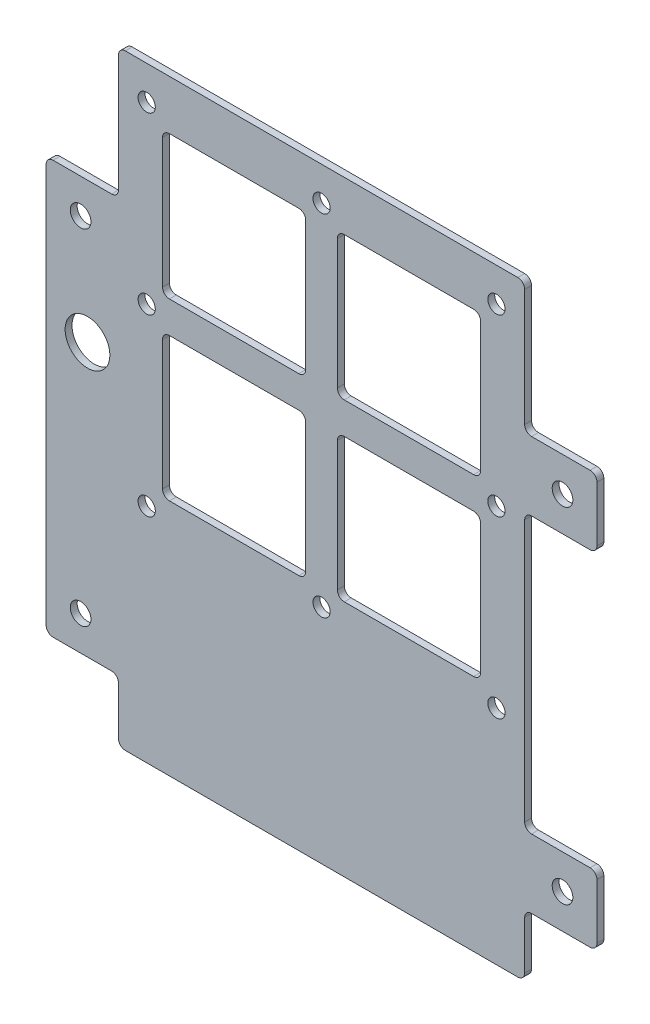
from build123d import *

# Parameters (mm, degrees)
MODEL_R         = 1.5
MODEL_R_2       = 3.25
MODEL_R_3       = 1.25
EXTRUDE_1_DEPTH = 1


with BuildPart() as part:
    # Model → Бобышка-Вытянуть1 (new body)
    with BuildSketch(Plane.XY):
        with BuildLine():
            Line((-28.5, -69), (28.5, -69))
            ThreePointArc((28.5, -69), (29.207106781, -68.707106781), (29.5, -68))
            Line((29.5, -68), (29.5, -61))
            ThreePointArc((29.5, -61), (29.792893219, -60.292893219), (30.5, -60))
            Line((30.5, -60), (39, -60))
            ThreePointArc((39, -60), (39.707106781, -59.707106781), (40, -59))
            Line((40, -59), (40, -55))
            Line((40, -55), (40, -51))
            ThreePointArc((40, -51), (39.707106781, -50.292893219), (39, -50))
            Line((39, -50), (30.5, -50))
            ThreePointArc((30.5, -50), (29.792893219, -49.707106781), (29.5, -49))
            Line((29.5, -49), (29.5, -11))
            ThreePointArc((29.5, -11), (29.792893219, -10.292893219), (30.5, -10))
            Line((30.5, -10), (39, -10))
            ThreePointArc((39, -10), (39.707106781, -9.707106781), (40, -9))
            Line((40, -9), (40, -5))
            Line((40, -5), (40, -1))
            ThreePointArc((40, -1), (39.707106781, -0.292893219), (39, 0))
            Line((39, 0), (30.5, 0))
            ThreePointArc((30.5, 0), (29.792893219, 0.292893219), (29.5, 1))
            Line((29.5, 1), (29.5, 18))
            ThreePointArc((29.5, 18), (29.207106781, 18.707106781), (28.5, 19))
            Line((28.5, 19), (-28.5, 19))
            ThreePointArc((-28.5, 19), (-29.207106781, 18.707106781), (-29.5, 18))
            Line((-29.5, 18), (-29.5, 1))
            ThreePointArc((-29.5, 1), (-29.792893219, 0.292893219), (-30.5, 0))
            Line((-30.5, 0), (-39, 0))
            ThreePointArc((-39, 0), (-39.707106781, -0.292893219), (-40, -1))
            Line((-40, -1), (-40, -5))
            Line((-40, -5), (-40, -9))
            Line((-40, -9), (-40, -52))
            Line((-40, -52), (-40, -55))
            Line((-40, -55), (-40, -59))
            ThreePointArc((-40, -59), (-39.707106781, -59.707106781), (-39, -60))
            Line((-39, -60), (-30.5, -60))
            ThreePointArc((-30.5, -60), (-29.792893219, -60.292893219), (-29.5, -61))
            Line((-29.5, -61), (-29.5, -68))
            ThreePointArc((-29.5, -68), (-29.207106781, -68.707106781), (-28.5, -69))
        make_face()
        with Locations((-35, -5)):
            Circle(MODEL_R, mode=Mode.SUBTRACT)
        with Locations((-35, -55)):
            Circle(MODEL_R, mode=Mode.SUBTRACT)
        with Locations((35, -5)):
            Circle(MODEL_R, mode=Mode.SUBTRACT)
        with Locations((35, -55)):
            Circle(MODEL_R, mode=Mode.SUBTRACT)
        with Locations((-34, -20.4)):
            Circle(MODEL_R_2, mode=Mode.SUBTRACT)
        with Locations((25.4, -36.7)):
            Circle(MODEL_R_3, mode=Mode.SUBTRACT)
        with Locations((0, -36.7)):
            Circle(MODEL_R_3, mode=Mode.SUBTRACT)
        with Locations((25.4, 14.1)):
            Circle(MODEL_R_3, mode=Mode.SUBTRACT)
        with Locations((0, 14.1)):
            Circle(MODEL_R_3, mode=Mode.SUBTRACT)
        with Locations((-25.4, -11.3)):
            Circle(MODEL_R_3, mode=Mode.SUBTRACT)
        with Locations((-25.4, -36.7)):
            Circle(MODEL_R_3, mode=Mode.SUBTRACT)
        with Locations((-25.4, 14.1)):
            Circle(MODEL_R_3, mode=Mode.SUBTRACT)
        with Locations((25.4, -11.3)):
            Circle(MODEL_R_3, mode=Mode.SUBTRACT)
        with BuildLine():
            Line((-2.3, -8), (-2.3, 10.8))
            ThreePointArc((-2.3, 10.8), (-2.592893219, 11.507106781), (-3.3, 11.8))
            Line((-3.3, 11.8), (-22.1, 11.8))
            ThreePointArc((-22.1, 11.8), (-22.807106781, 11.507106781), (-23.1, 10.8))
            Line((-23.1, 10.8), (-23.1, -8))
            ThreePointArc((-23.1, -8), (-22.807106781, -8.707106781), (-22.1, -9))
            Line((-22.1, -9), (-3.3, -9))
            ThreePointArc((-3.3, -9), (-2.592893219, -8.707106781), (-2.3, -8))
        make_face(mode=Mode.SUBTRACT)
        with BuildLine():
            Line((2.3, -8), (2.3, 10.8))
            ThreePointArc((2.3, 10.8), (2.592893219, 11.507106781), (3.3, 11.8))
            Line((3.3, 11.8), (22.1, 11.8))
            ThreePointArc((22.1, 11.8), (22.807106781, 11.507106781), (23.1, 10.8))
            Line((23.1, 10.8), (23.1, -8))
            ThreePointArc((23.1, -8), (22.807106781, -8.707106781), (22.1, -9))
            Line((22.1, -9), (3.3, -9))
            ThreePointArc((3.3, -9), (2.592893219, -8.707106781), (2.3, -8))
        make_face(mode=Mode.SUBTRACT)
        with BuildLine():
            Line((-2.3, -14.6), (-2.3, -33.4))
            ThreePointArc((-2.3, -33.4), (-2.592893219, -34.107106781), (-3.3, -34.4))
            Line((-3.3, -34.4), (-22.1, -34.4))
            ThreePointArc((-22.1, -34.4), (-22.807106781, -34.107106781), (-23.1, -33.4))
            Line((-23.1, -33.4), (-23.1, -14.6))
            ThreePointArc((-23.1, -14.6), (-22.807106781, -13.892893219), (-22.1, -13.6))
            Line((-22.1, -13.6), (-3.3, -13.6))
            ThreePointArc((-3.3, -13.6), (-2.592893219, -13.892893219), (-2.3, -14.6))
        make_face(mode=Mode.SUBTRACT)
        with BuildLine():
            Line((2.3, -14.6), (2.3, -33.4))
            ThreePointArc((2.3, -33.4), (2.592893219, -34.107106781), (3.3, -34.4))
            Line((3.3, -34.4), (22.1, -34.4))
            ThreePointArc((22.1, -34.4), (22.807106781, -34.107106781), (23.1, -33.4))
            Line((23.1, -33.4), (23.1, -14.6))
            ThreePointArc((23.1, -14.6), (22.807106781, -13.892893219), (22.1, -13.6))
            Line((22.1, -13.6), (3.3, -13.6))
            ThreePointArc((3.3, -13.6), (2.592893219, -13.892893219), (2.3, -14.6))
        make_face(mode=Mode.SUBTRACT)
    extrude(amount=EXTRUDE_1_DEPTH)


solid = part.part
